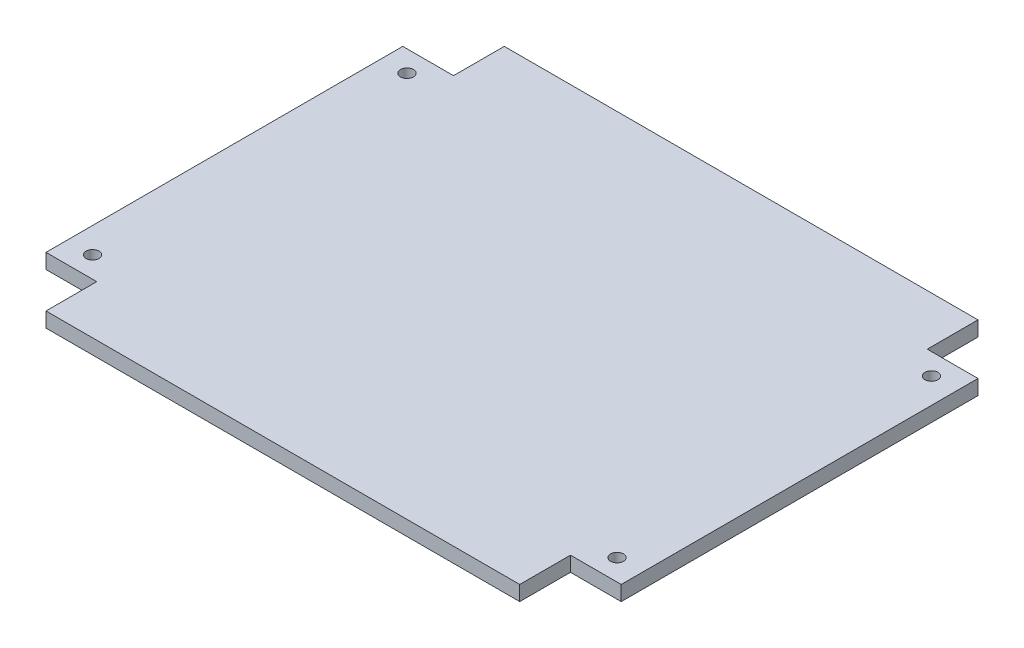
from build123d import *

# Parameters (mm, degrees)
SKETCH1_W           = 215.9
SKETCH1_H           = 172.003199808
BOSS_EXTRUDE1_DEPTH = 5.588
SKETCH2_W           = 19.05
SKETCH2_H           = 19.05
CORNERCUT_DEPTH     = 139.132919429
SKETCH3_R           = 2.4257
MOUNTHOLES_DEPTH    = 139.132919429


with BuildPart() as part:
    # Sketch1 → Boss-Extrude1 (new body)
    with BuildSketch(Plane(origin=(0, 0, 0), x_dir=(1, 0, 0), z_dir=(0, 1, 0))):
        Rectangle(SKETCH1_W, SKETCH1_H)
    extrude(amount=BOSS_EXTRUDE1_DEPTH)

    # Sketch2 → CornerCut (cut, through all)
    with BuildSketch(Plane(origin=(0, 5.588, 0), x_dir=(1, 0, 0), z_dir=(0, 1, 0))):
        with Locations((-98.425, 76.476599904)):
            Rectangle(SKETCH2_W, SKETCH2_H)
        with Locations((98.425, 76.476599904)):
            Rectangle(SKETCH2_W, SKETCH2_H)
        with Locations((98.425, -76.476599904)):
            Rectangle(SKETCH2_W, SKETCH2_H)
        with Locations((-98.425, -76.476599904)):
            Rectangle(SKETCH2_W, SKETCH2_H)
    extrude(amount=-CORNERCUT_DEPTH, mode=Mode.SUBTRACT)

    # Sketch3 → MountHoles (cut, through all)
    with BuildSketch(Plane(origin=(0, 5.588, 0), x_dir=(1, 0, 0), z_dir=(0, 1, 0))):
        with Locations(Location((-98.425, 59.014099904, 0), (0, 0, 270))):
            Circle(SKETCH3_R)
        with Locations(Location((-98.425, -59.014099904, 0), (0, 0, 270))):
            Circle(SKETCH3_R)
        with Locations(Location((98.425, -59.014099904, 0), (0, 0, 270))):
            Circle(SKETCH3_R)
        with Locations(Location((98.425, 59.014099904, 0), (0, 0, 270))):
            Circle(SKETCH3_R)
    extrude(amount=-MOUNTHOLES_DEPTH, mode=Mode.SUBTRACT)


solid = part.part
